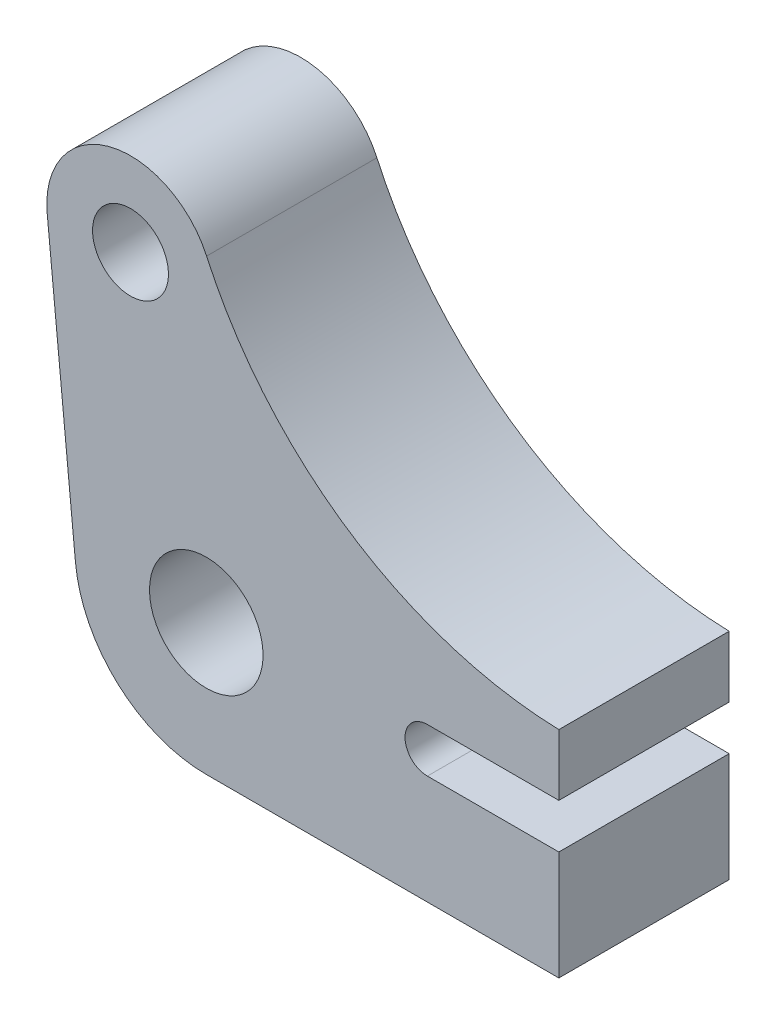
from build123d import *

# Parameters (mm, degrees)
ESQUISSE1_R        = 6.35
ESQUISSE1_R_2      = 9.5
BOSS_EXTRU_1_DEPTH = 28.5


with BuildPart() as part:
    # Esquisse1 → Boss.-Extru.1 (new body)
    with BuildSketch(Plane.XY):
        with BuildLine():
            Line((-74.269831122, -14.050908363), (-69.549469101, -62.162426551))
            ThreePointArc((-69.549469101, -62.162426551), (-62.431950288, -76.312412018), (-47.654598332, -82.014256626))
            Line((-47.654598332, -82.014256626), (11.345401668, -82.014256626))
            Line((11.345401668, -82.014256626), (11.345401668, -63.751175412))
            Line((11.345401668, -63.751175412), (-10.654598332, -63.751175412))
            ThreePointArc((-10.654598332, -63.751175412), (-14.391517119, -60.014256626), (-10.654598332, -56.27733784))
            Line((-10.654598332, -56.27733784), (11.345401668, -56.27733784))
            Line((11.345401668, -56.27733784), (11.345401668, -46.014256626))
            ThreePointArc((11.345401668, -46.014256626), (-23.716977968, -34.858356839), (-47.601181026, -6.869619639))
            ThreePointArc((-47.601181026, -6.869619639), (-63.976959265, 0.834568173), (-74.269831122, -14.050908363))
        make_face()
        with Locations(Location((-60.336723839, -12.683889074, 0), (0, 0, 180))):
            Circle(ESQUISSE1_R, mode=Mode.SUBTRACT)
        with Locations(Location((-47.654598332, -60.014256626, 0), (0, 0, 180))):
            Circle(ESQUISSE1_R_2, mode=Mode.SUBTRACT)
    extrude(amount=BOSS_EXTRU_1_DEPTH)


solid = part.part
